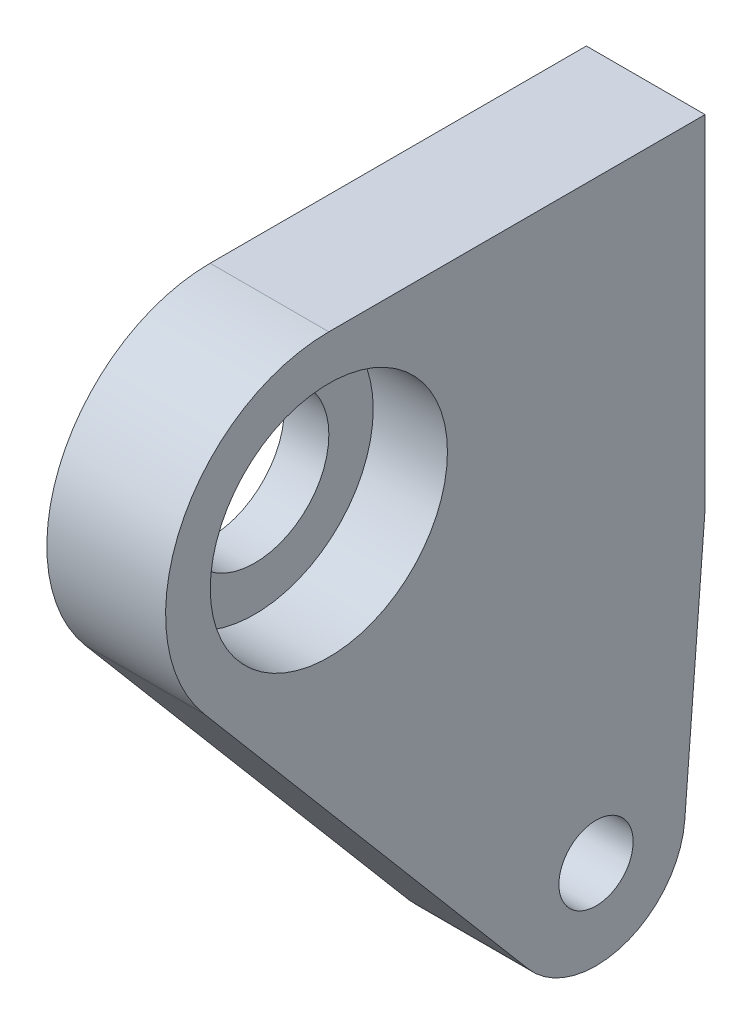
from build123d import *

# Parameters (mm, degrees)
SKETCH27_R                  = 5
SKETCH27_R_2                = 2.5
BOSS_EXTRUDE1_DEPTH         = 8
TAP_DRILL_FOR_M3_TAP1_D     = 2.5
TAP_DRILL_FOR_M3_TAP1_DEPTH = 10
TAP_DRILL_FOR_M3_TAP1_TIP   = 0.751075774
SKETCH33_R                  = 7.99
CUT_EXTRUDE2_DEPTH          = 5


with BuildPart() as part:
    # Sketch27 → Boss-Extrude1 (new body)
    with BuildSketch(Plane(origin=(0, 0, 0), x_dir=(0, 0, -1), z_dir=(1, 0, 0))):
        with BuildLine():
            Line((12, 48), (37.349351573, 48))
            Line((37.349351573, 48), (37.349351573, 25))
            Line((37.349351573, 25), (35.981694484, 7.531672014))
            ThreePointArc((35.981694484, 7.531672014), (31.842856312, 2.290019211), (25.420672816, 4.12317623))
            Line((25.420672816, 4.12317623), (3.604566829, 29.892489756))
            ThreePointArc((3.604566829, 29.892489756), (2.020455604, 41.626952956), (12, 48))
        make_face()
        with Locations((12, 37)):
            Circle(SKETCH27_R, mode=Mode.SUBTRACT)
        with Locations((30, 8)):
            Circle(SKETCH27_R_2, mode=Mode.SUBTRACT)
    extrude(amount=BOSS_EXTRUDE1_DEPTH)

    # Tap Drill for M3 Tap1
    with Locations(Plane(origin=(0, 0, -37.349351573), x_dir=(-1, 0, 0), z_dir=(0, 0, -1))):
        with Locations((-3, 32), (-3, 44)):
            Hole(TAP_DRILL_FOR_M3_TAP1_D / 2, depth=TAP_DRILL_FOR_M3_TAP1_DEPTH)
            with Locations((0, 0, -(TAP_DRILL_FOR_M3_TAP1_DEPTH + TAP_DRILL_FOR_M3_TAP1_TIP / 2))):  # 118° drill point
                Cone(0, TAP_DRILL_FOR_M3_TAP1_D / 2, TAP_DRILL_FOR_M3_TAP1_TIP, mode=Mode.SUBTRACT)

    # Sketch33 → Cut-Extrude2 (cut)
    with BuildSketch(Plane(origin=(8, 0, 0), x_dir=(0, 0, -1), z_dir=(1, 0, 0))):
        with Locations((12, 37)):
            Circle(SKETCH33_R)
    extrude(amount=-CUT_EXTRUDE2_DEPTH, mode=Mode.SUBTRACT)


solid = part.part
